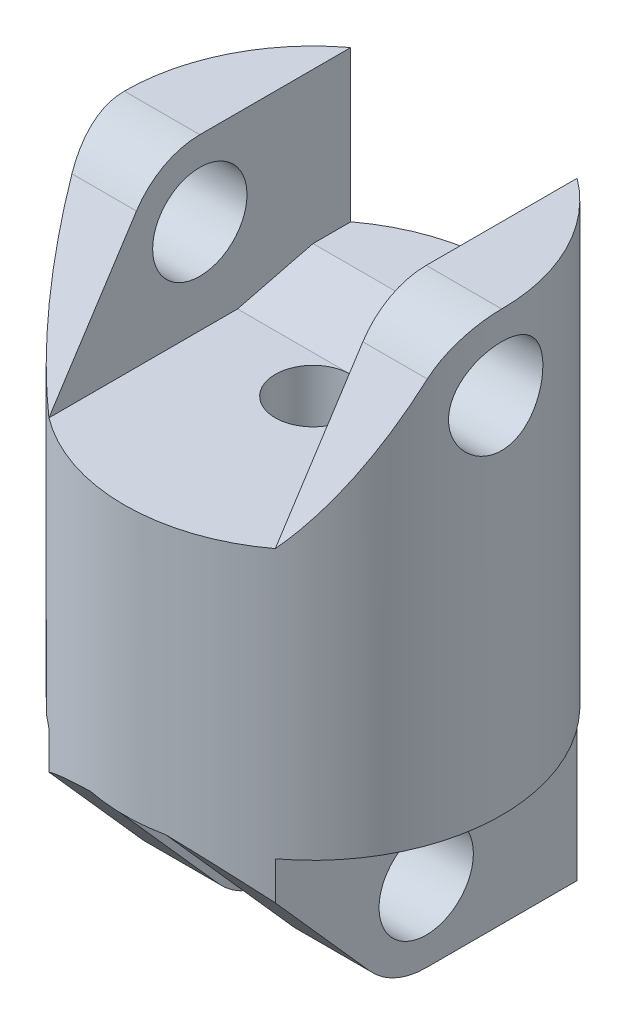
from build123d import *

# Parameters (mm, degrees)
SKETCH1_R               = 12.7
BOSS_EXTRUDE1_DEPTH     = 40.9448
CUT_EXTRUDE1_START      = -11.43
CUT_EXTRUDE1_DEPTH      = 11.43
CUT_EXTRUDE2_DEPTH      = 11.43
CUT_EXTRUDE3_DEPTH      = 48.441216753
CUT_EXTRUDE3_DEPTH_BACK = 48.441216753
SKETCH4_R               = 3.175
SKETCH5_R               = 2.54
CUT_EXTRUDE4_DEPTH      = 35.550013459
BOSS_EXTRUDE2_REACH     = 49.441
BOSS_EXTRUDE3_DEPTH     = 1.27


with BuildPart() as part:
    # Sketch1 → Boss-Extrude1 (new body)
    with BuildSketch(Plane(origin=(0, 0, 0), x_dir=(1, 0, 0), z_dir=(0, 1, 0))):
        with Locations(Location((0, 0, 0), (0, 0, 270))):
            Circle(SKETCH1_R)
    extrude(amount=BOSS_EXTRUDE1_DEPTH)

    # Sketch2 → Cut-Extrude1 (cut)
    with BuildSketch(Plane(origin=(0, 40.9448, 0), x_dir=(1, 0, 0), z_dir=(0, 1, 0)).offset(CUT_EXTRUDE1_START)):
        with BuildLine():
            Line((7.62, 10.16), (7.62, -10.16))
            ThreePointArc((7.62, -10.16), (0, -12.7), (-7.62, -10.16))
            Line((-7.62, -10.16), (-7.62, 10.16))
            ThreePointArc((-7.62, 10.16), (0, 12.7), (7.62, 10.16))
        make_face()
    extrude(amount=CUT_EXTRUDE1_DEPTH, mode=Mode.SUBTRACT)

    # Sketch3 → Cut-Extrude2 (cut)
    with BuildSketch(Plane.XZ):
        with BuildLine():
            Line((-2.54, 12.443407893), (-2.54, -12.443407893))
            ThreePointArc((-2.54, -12.443407893), (0, -12.7), (2.54, -12.443407893))
            Line((2.54, -12.443407893), (2.54, 12.443407893))
            ThreePointArc((2.54, 12.443407893), (0, 12.7), (-2.54, 12.443407893))
        make_face()
        with BuildLine():
            Line((-7.62, 10.16), (-7.62, -10.16))
            ThreePointArc((-7.62, -10.16), (-12.7, 0), (-7.62, 10.16))
        make_face()
        with BuildLine():
            Line((7.62, 10.16), (7.62, -10.16))
            ThreePointArc((7.62, -10.16), (12.7, 0), (7.62, 10.16))
        make_face()
    extrude(amount=-CUT_EXTRUDE2_DEPTH, mode=Mode.SUBTRACT)

    # Sketch4 → Cut-Extrude3 (cut, two sides: drawn at the far end of the back side and taken through both)
    with BuildSketch(Plane(origin=(-7.62, 0, 0), x_dir=(0, 0, -1), z_dir=(1, 0, 0)).offset(-CUT_EXTRUDE3_DEPTH_BACK)):
        with Locations(Location((0, 35.8648, 0), (0, 0, 270))):
            Circle(SKETCH4_R)
        with Locations((0, 5.08)):
            Circle(SKETCH4_R)
        with BuildLine():
            Line((0, 40.9448), (-10.16, 40.9448))
            Line((-10.16, 40.9448), (-10.16, 29.5148))
            Line((-10.16, 29.5148), (-4.264917923, 38.624668677))
            ThreePointArc((-4.264917923, 38.624668677), (-2.427577715, 40.327228312), (0, 40.9448))
        make_face()
        with BuildLine():
            Line((0, 0), (-12.443407893, 0))
            Line((-12.443407893, 0), (-12.443407893, 11.43))
            Line((-12.443407893, 11.43), (-3.796422114, 1.704562379))
            ThreePointArc((-3.796422114, 1.704562379), (-2.080766311, 0.445691901), (0, 0))
        make_face()
    extrude(amount=CUT_EXTRUDE3_DEPTH + CUT_EXTRUDE3_DEPTH_BACK, mode=Mode.SUBTRACT)

    # Sketch5 → Cut-Extrude4 (cut, through all)
    with BuildSketch(Plane(origin=(0, 29.5148, 0), x_dir=(1, 0, 0), z_dir=(0, 1, 0))):
        with Locations(Location((0, 0, 0), (0, 0, 270))):
            Circle(SKETCH5_R)
    extrude(amount=-CUT_EXTRUDE4_DEPTH, mode=Mode.SUBTRACT)

    # Boss-Extrude2: up to this face of the body (flat: up to its plane)
    boss_extrude2_end = Plane(part.part.faces().sort_by_distance((7.62, 29.747941009, 0))[0])
    # Sketch6 → Boss-Extrude2 (add, up to the picked face)
    with BuildSketch(Plane(origin=(-7.62, 0, 0), x_dir=(0, 0, -1), z_dir=(1, 0, 0)), mode=Mode.PRIVATE) as boss_extrude2_sk1:
        Polygon((2.54, 29.5148), (10.16, 29.5148), (10.16, 30.7848), (7.62, 30.7848), align=None)
    boss_extrude2_tool1 = split(extrude(boss_extrude2_sk1.sketch, amount=BOSS_EXTRUDE2_REACH, mode=Mode.PRIVATE), bisect_by=boss_extrude2_end, keep=Keep.BOTH, mode=Mode.PRIVATE)
    add(boss_extrude2_tool1.solids().sort_by(Axis((-7.62, 30.043967, -7.408333), (1, 0, 0)))[0])

    # Sketch7 → Boss-Extrude3 (add)
    with BuildSketch(Plane(origin=(0, 29.5148, 0), x_dir=(1, 0, 0), z_dir=(0, 1, 0))):
        with BuildLine():
            Line((-7.62, 10.16), (7.62, 10.16))
            ThreePointArc((7.62, 10.16), (0, 12.7), (-7.62, 10.16))
        make_face()
    extrude(amount=BOSS_EXTRUDE3_DEPTH)


solid = part.part
